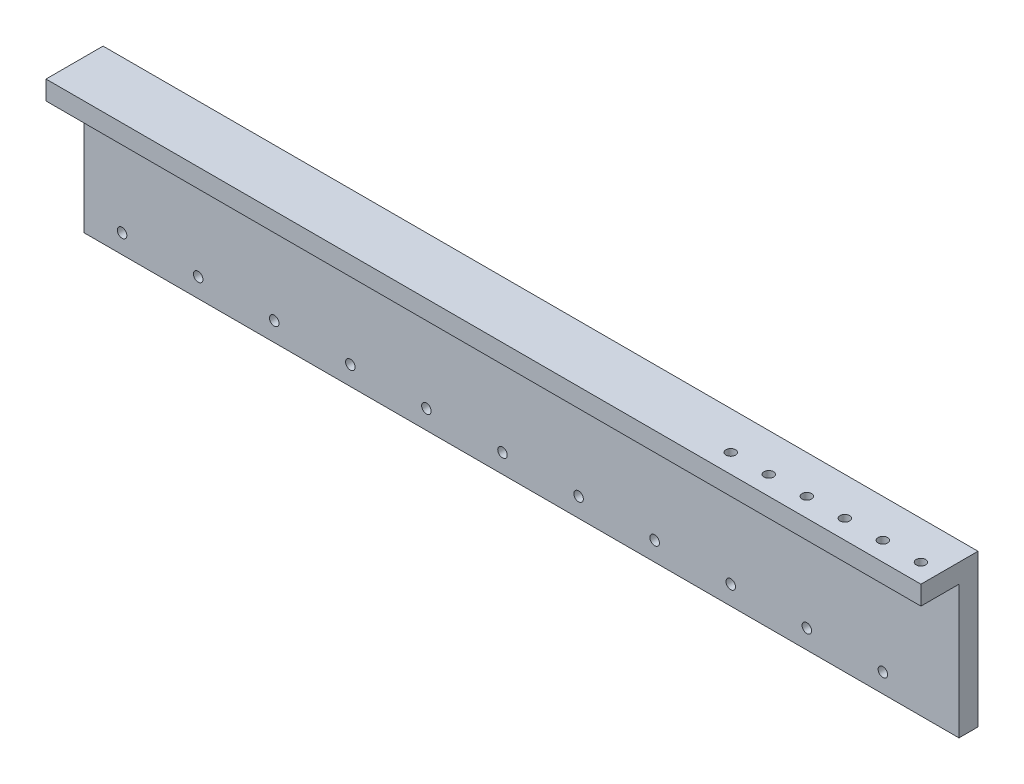
from build123d import *

# Parameters (mm, degrees)
SKETCH1_W           = 230
SKETCH1_H           = 40
SKETCH1_R           = 1.25
BOSS_EXTRUDE1_DEPTH = 5
SKETCH2_W           = 230
SKETCH2_H           = 5
BOSS_EXTRUDE2_DEPTH = 10
CUT_EXTRUDE1_REACH  = 124.678
SKETCH3_R           = 1.25


with BuildPart() as part:
    # Sketch1 → Boss-Extrude1 (new body)
    with BuildSketch(Plane.XY):
        Rectangle(SKETCH1_W, SKETCH1_H)
        with Locations((-105, -15)):
            Circle(SKETCH1_R, mode=Mode.SUBTRACT)
        with Locations((-85, -15)):
            Circle(SKETCH1_R, mode=Mode.SUBTRACT)
        with Locations((-65, -15)):
            Circle(SKETCH1_R, mode=Mode.SUBTRACT)
        with Locations((-45, -15)):
            Circle(SKETCH1_R, mode=Mode.SUBTRACT)
        with Locations((-25, -15)):
            Circle(SKETCH1_R, mode=Mode.SUBTRACT)
        with Locations((-5, -15)):
            Circle(SKETCH1_R, mode=Mode.SUBTRACT)
        with Locations((15, -15)):
            Circle(SKETCH1_R, mode=Mode.SUBTRACT)
        with Locations((35, -15)):
            Circle(SKETCH1_R, mode=Mode.SUBTRACT)
        with Locations((55, -15)):
            Circle(SKETCH1_R, mode=Mode.SUBTRACT)
        with Locations((75, -15)):
            Circle(SKETCH1_R, mode=Mode.SUBTRACT)
        with Locations((95, -15)):
            Circle(SKETCH1_R, mode=Mode.SUBTRACT)
    extrude(amount=BOSS_EXTRUDE1_DEPTH)

    # Sketch2 → Boss-Extrude2 (add)
    with BuildSketch(Plane.XY.offset(5)):
        with Locations((0, 17.5)):
            Rectangle(SKETCH2_W, SKETCH2_H)
    extrude(amount=BOSS_EXTRUDE2_DEPTH)

    # Sketch3 → Cut-Extrude1 (cut, up to next)
    with BuildSketch(Plane(origin=(0, 20, 0), x_dir=(1, 0, 0), z_dir=(0, 1, 0)), mode=Mode.PRIVATE) as cut_extrude1_sk1:
        with Locations(Location((110, -10, 0), (0, 0, 270))):
            Circle(SKETCH3_R)
    cut_extrude1_tool1 = extrude(cut_extrude1_sk1.sketch, amount=-CUT_EXTRUDE1_REACH, mode=Mode.PRIVATE) & part.part
    # Sketch3 → Cut-Extrude1 (cut, up to next)
    with BuildSketch(Plane(origin=(0, 20, 0), x_dir=(1, 0, 0), z_dir=(0, 1, 0)), mode=Mode.PRIVATE) as cut_extrude1_sk2:
        with Locations(Location((100, -10, 0), (0, 0, 270))):
            Circle(SKETCH3_R)
    cut_extrude1_tool2 = extrude(cut_extrude1_sk2.sketch, amount=-CUT_EXTRUDE1_REACH, mode=Mode.PRIVATE) & part.part
    # Sketch3 → Cut-Extrude1 (cut, up to next)
    with BuildSketch(Plane(origin=(0, 20, 0), x_dir=(1, 0, 0), z_dir=(0, 1, 0)), mode=Mode.PRIVATE) as cut_extrude1_sk3:
        with Locations(Location((90, -10, 0), (0, 0, 270))):
            Circle(SKETCH3_R)
    cut_extrude1_tool3 = extrude(cut_extrude1_sk3.sketch, amount=-CUT_EXTRUDE1_REACH, mode=Mode.PRIVATE) & part.part
    # Sketch3 → Cut-Extrude1 (cut, up to next)
    with BuildSketch(Plane(origin=(0, 20, 0), x_dir=(1, 0, 0), z_dir=(0, 1, 0)), mode=Mode.PRIVATE) as cut_extrude1_sk4:
        with Locations(Location((80, -10, 0), (0, 0, 270))):
            Circle(SKETCH3_R)
    cut_extrude1_tool4 = extrude(cut_extrude1_sk4.sketch, amount=-CUT_EXTRUDE1_REACH, mode=Mode.PRIVATE) & part.part
    # Sketch3 → Cut-Extrude1 (cut, up to next)
    with BuildSketch(Plane(origin=(0, 20, 0), x_dir=(1, 0, 0), z_dir=(0, 1, 0)), mode=Mode.PRIVATE) as cut_extrude1_sk5:
        with Locations(Location((70, -10, 0), (0, 0, 270))):
            Circle(SKETCH3_R)
    cut_extrude1_tool5 = extrude(cut_extrude1_sk5.sketch, amount=-CUT_EXTRUDE1_REACH, mode=Mode.PRIVATE) & part.part
    # Sketch3 → Cut-Extrude1 (cut, up to next)
    with BuildSketch(Plane(origin=(0, 20, 0), x_dir=(1, 0, 0), z_dir=(0, 1, 0)), mode=Mode.PRIVATE) as cut_extrude1_sk6:
        with Locations(Location((60, -10, 0), (0, 0, 270))):
            Circle(SKETCH3_R)
    cut_extrude1_tool6 = extrude(cut_extrude1_sk6.sketch, amount=-CUT_EXTRUDE1_REACH, mode=Mode.PRIVATE) & part.part
    add(cut_extrude1_tool1.solids().sort_by_distance((110, 20, 10))[0], mode=Mode.SUBTRACT)
    add(cut_extrude1_tool2.solids().sort_by_distance((100, 20, 10))[0], mode=Mode.SUBTRACT)
    add(cut_extrude1_tool3.solids().sort_by_distance((90, 20, 10))[0], mode=Mode.SUBTRACT)
    add(cut_extrude1_tool4.solids().sort_by_distance((80, 20, 10))[0], mode=Mode.SUBTRACT)
    add(cut_extrude1_tool5.solids().sort_by_distance((70, 20, 10))[0], mode=Mode.SUBTRACT)
    add(cut_extrude1_tool6.solids().sort_by_distance((60, 20, 10))[0], mode=Mode.SUBTRACT)


solid = part.part
